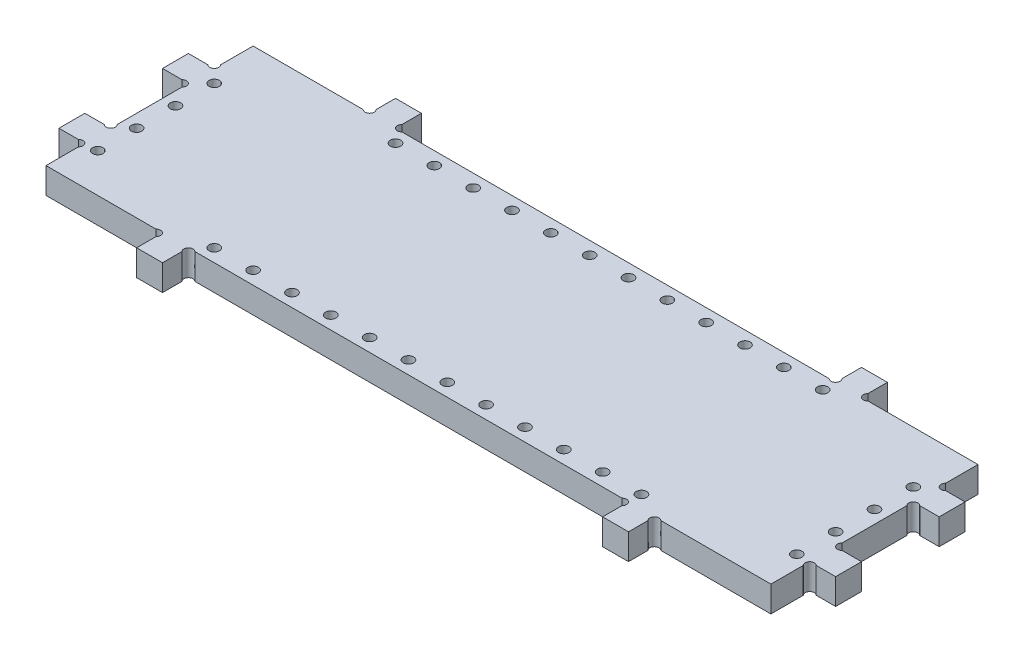
from build123d import *

# Parameters (mm, degrees)
SKETCH2_W                  = 355.6
SKETCH2_H                  = 101.6
RECTANGLE_EXTRUSION_DEPTH  = 12.7
SKETCH4_W                  = 12.7
SKETCH4_H                  = 12.7
FRONT_FACE_TABS_DEPTH      = 12.7
SKETCH6_R                  = 2.24536
TAB_CURVE_FRONT_BACK_DEPTH = 12.7
SKETCH7_W                  = 12.7
SKETCH7_H                  = 12.7
RIGHT_FACE_TABS_DEPTH      = 12.7
SKETCH8_R                  = 2.24536
TAB_CURVE_LEFT_RIGHT_DEPTH = 12.7
SKETCH9_R                  = 2.5527
CUT_EXTRUDE1_DEPTH         = 202.205839875


with BuildPart() as part:
    # Sketch2 → Rectangle Extrusion (new body)
    with BuildSketch(Plane(origin=(0, 0, 0), x_dir=(1, 0, 0), z_dir=(0, 1, 0))):
        Rectangle(SKETCH2_W, SKETCH2_H)
    extrude(amount=RECTANGLE_EXTRUSION_DEPTH)

    # Sketch4 → Front Face Tabs (add)
    with BuildSketch(Plane.XY.offset(50.8)):
        with Locations((-114.3, 6.35)):
            Rectangle(SKETCH4_W, SKETCH4_H)
        with Locations((114.3, 6.35)):
            Rectangle(SKETCH4_W, SKETCH4_H)
    front_face_tabs = extrude(amount=FRONT_FACE_TABS_DEPTH)

    # Mirror Rear Face Tabs: Front Face Tabs across plane
    add(front_face_tabs.mirror(Plane.XY))

    # Sketch6 → Tab Curve Front Back (cut)
    with BuildSketch(Plane(origin=(0, 12.7, 0), x_dir=(1, 0, 0), z_dir=(0, 1, 0))):
        with Locations((-122.2375, 52.3875)):
            Circle(SKETCH6_R)
        with Locations((-106.3625, 52.3875)):
            Circle(SKETCH6_R)
        with Locations((106.3625, 52.3875)):
            Circle(SKETCH6_R)
        with Locations((122.2375, 52.3875)):
            Circle(SKETCH6_R)
        with Locations((122.2375, -52.3875)):
            Circle(SKETCH6_R)
        with Locations((106.3625, -52.3875)):
            Circle(SKETCH6_R)
        with Locations((-106.3625, -52.3875)):
            Circle(SKETCH6_R)
        with Locations((-122.2375, -52.3875)):
            Circle(SKETCH6_R)
    extrude(amount=-TAB_CURVE_FRONT_BACK_DEPTH, mode=Mode.SUBTRACT)

    # Sketch7 → Right Face Tabs (add)
    with BuildSketch(Plane(origin=(177.8, 0, 0), x_dir=(0, 0, -1), z_dir=(1, 0, 0))):
        with Locations((-25.4, 6.35)):
            Rectangle(SKETCH7_W, SKETCH7_H)
        with Locations((25.4, 6.35)):
            Rectangle(SKETCH7_W, SKETCH7_H)
    right_face_tabs = extrude(amount=RIGHT_FACE_TABS_DEPTH)

    # Mirror Left Face Tabs: Right Face Tabs across plane
    add(right_face_tabs.mirror(Plane(origin=(0, 0, 0), x_dir=(0, 0, 1), z_dir=(1, 0, 0))))

    # Sketch8 → Tab Curve Left Right (cut)
    with BuildSketch(Plane(origin=(0, 12.7, 0), x_dir=(1, 0, 0), z_dir=(0, 1, 0))):
        with Locations((179.3875, 33.3375)):
            Circle(SKETCH8_R)
        with Locations((179.3875, 17.4625)):
            Circle(SKETCH8_R)
        with Locations((179.3875, -17.4625)):
            Circle(SKETCH8_R)
        with Locations((179.3875, -33.3375)):
            Circle(SKETCH8_R)
        with Locations((-179.3875, -33.3375)):
            Circle(SKETCH8_R)
        with Locations((-179.3875, -17.4625)):
            Circle(SKETCH8_R)
        with Locations((-179.3875, 17.4625)):
            Circle(SKETCH8_R)
        with Locations((-179.3875, 33.3375)):
            Circle(SKETCH8_R)
    extrude(amount=-TAB_CURVE_LEFT_RIGHT_DEPTH, mode=Mode.SUBTRACT)

    # Sketch9 → Cut-Extrude1 (cut, through all)
    with BuildSketch(Plane.XZ):
        with Locations(Location((-101.6, 44.45, 0), (0, 0, 270))):
            Circle(SKETCH9_R)
        with Locations(Location((-82.55, 44.45, 0), (0, 0, 270))):
            Circle(SKETCH9_R)
        with Locations(Location((-63.5, 44.45, 0), (0, 0, 270))):
            Circle(SKETCH9_R)
        with Locations(Location((-44.45, 44.45, 0), (0, 0, 270))):
            Circle(SKETCH9_R)
        with Locations(Location((-25.4, 44.45, 0), (0, 0, 270))):
            Circle(SKETCH9_R)
        with Locations(Location((-6.35, 44.45, 0), (0, 0, 270))):
            Circle(SKETCH9_R)
        with Locations(Location((12.7, 44.45, 0), (0, 0, 270))):
            Circle(SKETCH9_R)
        with Locations(Location((31.75, 44.45, 0), (0, 0, 270))):
            Circle(SKETCH9_R)
        with Locations(Location((50.8, 44.45, 0), (0, 0, 270))):
            Circle(SKETCH9_R)
        with Locations(Location((69.85, 44.45, 0), (0, 0, 270))):
            Circle(SKETCH9_R)
        with Locations(Location((88.9, 44.45, 0), (0, 0, 270))):
            Circle(SKETCH9_R)
        with Locations(Location((107.95, 44.45, 0), (0, 0, 270))):
            Circle(SKETCH9_R)
        with Locations(Location((107.95, -44.45, 0), (0, 0, 90))):
            Circle(SKETCH9_R)
        with Locations(Location((88.9, -44.45, 0), (0, 0, 90))):
            Circle(SKETCH9_R)
        with Locations(Location((69.85, -44.45, 0), (0, 0, 90))):
            Circle(SKETCH9_R)
        with Locations(Location((50.8, -44.45, 0), (0, 0, 90))):
            Circle(SKETCH9_R)
        with Locations(Location((31.75, -44.45, 0), (0, 0, 90))):
            Circle(SKETCH9_R)
        with Locations(Location((12.7, -44.45, 0), (0, 0, 90))):
            Circle(SKETCH9_R)
        with Locations(Location((-6.35, -44.45, 0), (0, 0, 90))):
            Circle(SKETCH9_R)
        with Locations(Location((-25.4, -44.45, 0), (0, 0, 90))):
            Circle(SKETCH9_R)
        with Locations(Location((-44.45, -44.45, 0), (0, 0, 90))):
            Circle(SKETCH9_R)
        with Locations(Location((-63.5, -44.45, 0), (0, 0, 90))):
            Circle(SKETCH9_R)
        with Locations(Location((-82.55, -44.45, 0), (0, 0, 90))):
            Circle(SKETCH9_R)
        with Locations(Location((-101.6, -44.45, 0), (0, 0, 90))):
            Circle(SKETCH9_R)
        with Locations(Location((171.45, -25.4, 0), (0, 0, 270))):
            Circle(SKETCH9_R)
        with Locations(Location((171.45, -6.35, 0), (0, 0, 270))):
            Circle(SKETCH9_R)
        with Locations(Location((171.45, 12.7, 0), (0, 0, 270))):
            Circle(SKETCH9_R)
        with Locations(Location((171.45, 31.75, 0), (0, 0, 270))):
            Circle(SKETCH9_R)
        with Locations(Location((-171.45, -25.4, 0), (0, 0, 90))):
            Circle(SKETCH9_R)
        with Locations(Location((-171.45, -6.35, 0), (0, 0, 90))):
            Circle(SKETCH9_R)
        with Locations(Location((-171.45, 12.7, 0), (0, 0, 90))):
            Circle(SKETCH9_R)
        with Locations(Location((-171.45, 31.75, 0), (0, 0, 90))):
            Circle(SKETCH9_R)
    extrude(amount=-CUT_EXTRUDE1_DEPTH, mode=Mode.SUBTRACT)


solid = part.part
